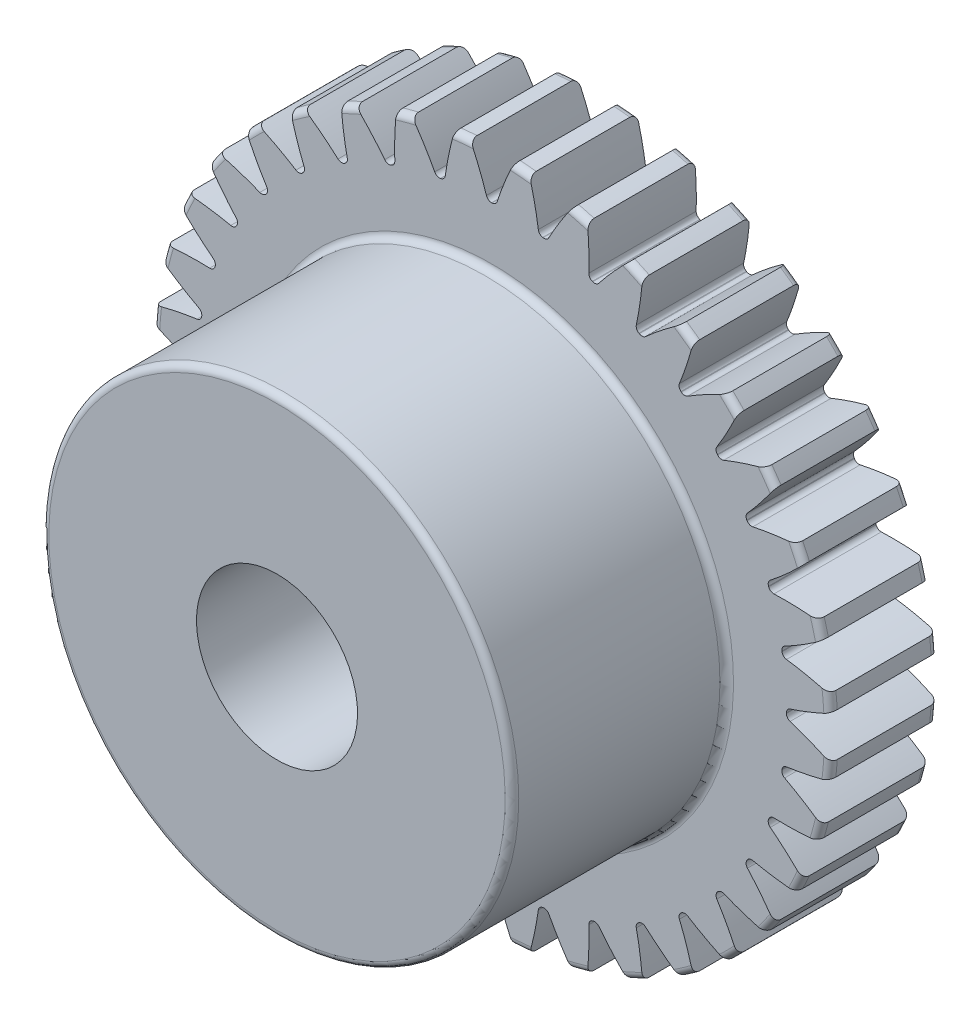
from build123d import *

# Parameters (mm, degrees)
FILLET2_R          = 0.20066
CUT_EXTRUDE2_DEPTH = 16.544924574
CIRPATTERN1_COUNT  = 36


with BuildPart() as part:
    # Sketch4 → Revolve1 (revolve)
    with BuildSketch(Plane(origin=(0, 0, 0), x_dir=(0, 0, -1), z_dir=(1, 0, 0))):
        Polygon((-9.525, 2.38125), (-9.525, 6.9469), (-3.175, 6.9469), (-3.175, 10.033), (0, 10.033), (0, 2.38125), align=None)
    revolve(axis=Axis((0, 0, 3.175), (0, 0, 1)))

    # Fillet2
    fillet2_edges = [part.edges().sort_by_distance(p)[0] for p in [
        (0, -10.033, 0),
        (0, -10.033, 3.175),
        (0, -6.9469, 3.175),
        (0, -6.9469, 9.525),
    ]]
    fillet(fillet2_edges, radius=FILLET2_R)

    # Sketch7 → Cut-Extrude2 (cut, through all)
    with BuildSketch(Plane.XY.offset(3.175)):
        with BuildLine():
            ThreePointArc((-0.007285042, 8.710080287), (0, 8.710083333), (0.007285042, 8.710080287))
            ThreePointArc((0.007285042, 8.710080287), (0.100643301, 8.740334031), (0.158379611, 8.819691274))
            ThreePointArc((0.158379611, 8.819691274), (0.378072362, 9.424294167), (0.638073261, 10.012689524))
            ThreePointArc((0.638073261, 10.012689524), (0, 10.033), (-0.638073261, 10.012689524))
            ThreePointArc((-0.638073261, 10.012689524), (-0.378072362, 9.424294167), (-0.158379611, 8.819691274))
            ThreePointArc((-0.158379611, 8.819691274), (-0.100643301, 8.740334031), (-0.007285042, 8.710080287))
        make_face()
    cut_extrude2 = extrude(amount=-CUT_EXTRUDE2_DEPTH, mode=Mode.SUBTRACT)

    # CirPattern1: Cut-Extrude2 ×36 about axis
    cirpattern1_axis = Axis((0, 0, 0), (0, 0, 1))
    for i in range(1, CIRPATTERN1_COUNT):
        add(cut_extrude2.rotate(cirpattern1_axis, i * 360 / CIRPATTERN1_COUNT), mode=Mode.SUBTRACT)


solid = part.part
